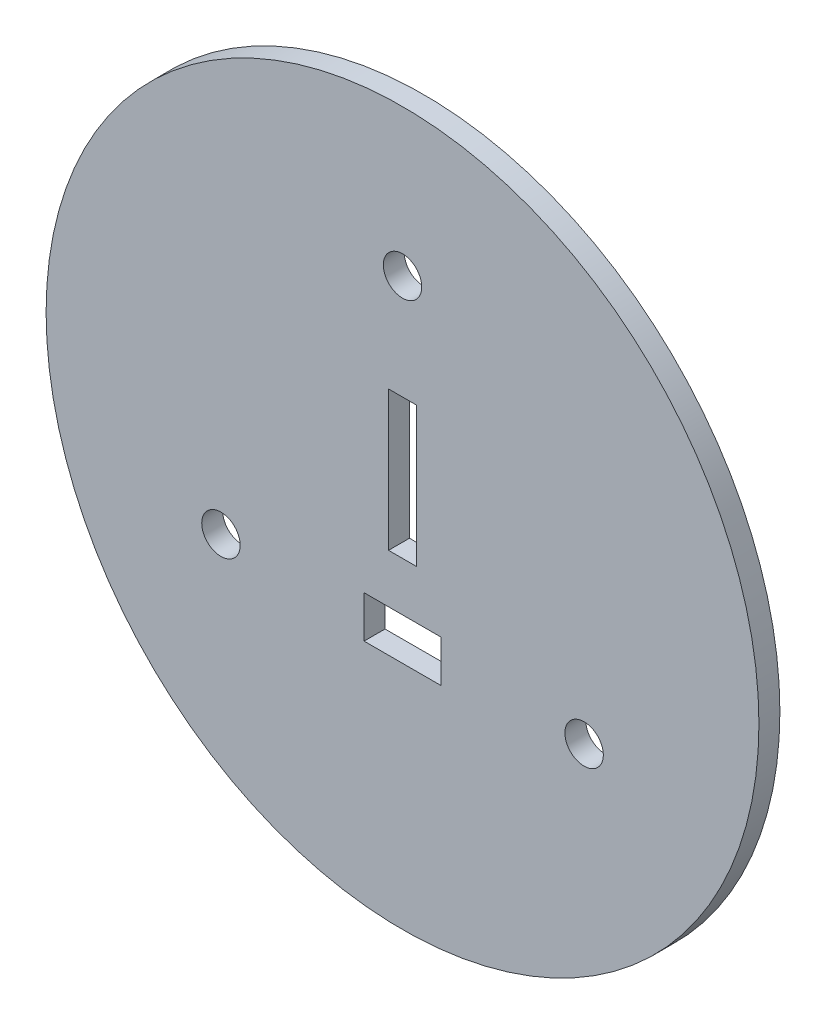
from build123d import *

# Parameters (mm, degrees)
SKETCH_2_R               = 51
EXTRUDE_1_DEPTH          = 3
SKETCH_3_R               = 2.75
CUT_EXTRUDE_1_DEPTH      = 3
PATTERN_CIRCULAR_1_COUNT = 3
CUT_EXTRUDE_START        = -13.3
SKETCH_4_R               = 2.75
SKETCH_4_W               = 4
SKETCH_4_H               = 20
SKETCH_4_W_2             = 11
SKETCH_4_H_2             = 6
CUT_EXTRUDE_2_DEPTH      = 13.3


with BuildPart() as part:
    # Эскиз2 → Бобышка-Вытянуть1 (new body)
    with BuildSketch(Plane.XY):
        Circle(SKETCH_2_R)
    extrude(amount=EXTRUDE_1_DEPTH)

    # Эскиз3 → Вырез-Вытянуть1 (cut)
    with BuildSketch(Plane(origin=(0, 0, 0), x_dir=(-1, 0, 0), z_dir=(0, 0, -1))):
        with Locations((0, 30)):
            Circle(SKETCH_3_R)
    cut_extrude_1 = extrude(amount=-CUT_EXTRUDE_1_DEPTH, mode=Mode.SUBTRACT)

    # Круговой массив1: Вырез-Вытянуть1 ×3 about axis
    pattern_circular_1_axis = Axis((0, 0, 0), (0, 0, 1))
    for i in range(1, PATTERN_CIRCULAR_1_COUNT):
        add(cut_extrude_1.rotate(pattern_circular_1_axis, i * 360 / PATTERN_CIRCULAR_1_COUNT), mode=Mode.SUBTRACT)

    # Эскиз4 → Вырез-Вытянуть2 (cut)
    with BuildSketch(Plane.XY.offset(3).offset(CUT_EXTRUDE_START)):
        with Locations(Location((0, 30, 0), (0, 0, 180))):
            Circle(SKETCH_4_R)
        with Locations((0, 5)):
            Rectangle(SKETCH_4_W, SKETCH_4_H)
        with Locations((0, -15)):
            Rectangle(SKETCH_4_W_2, SKETCH_4_H_2)
    extrude(amount=CUT_EXTRUDE_2_DEPTH, mode=Mode.SUBTRACT)


solid = part.part
